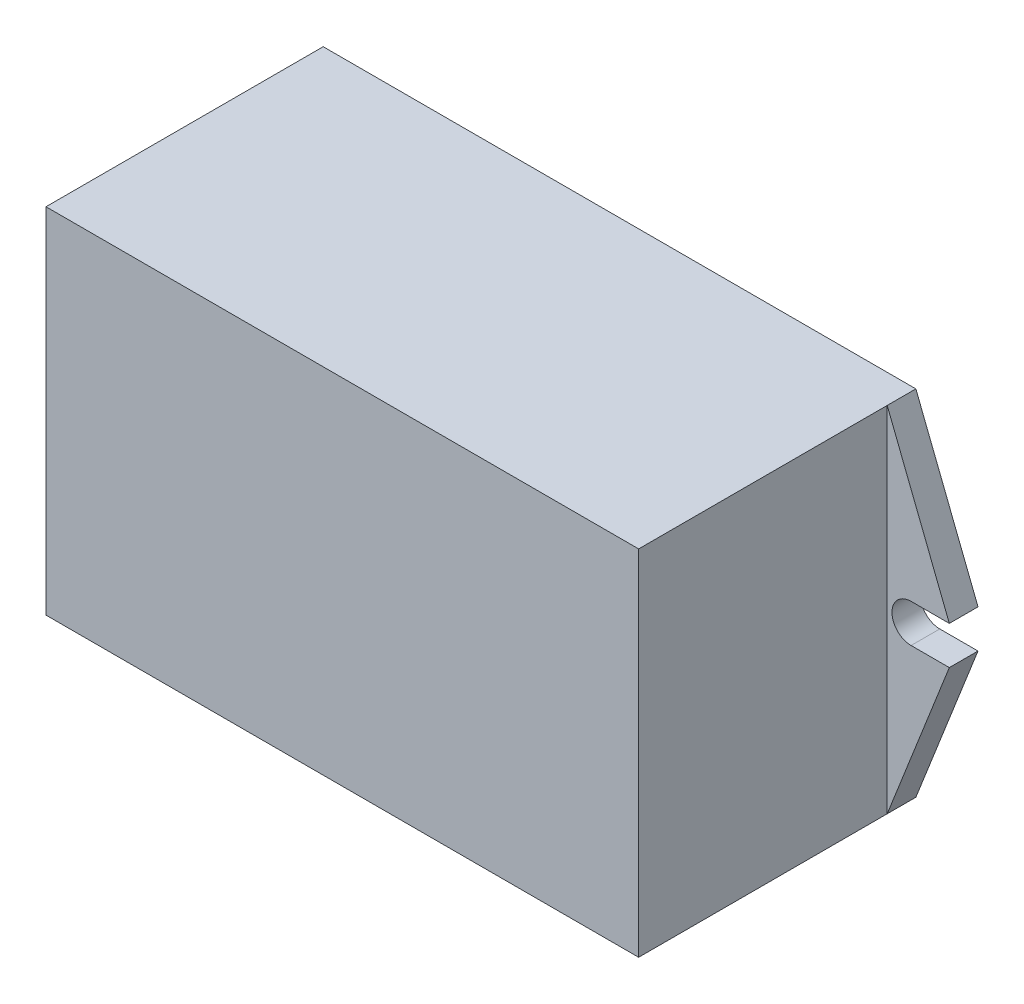
from build123d import *

# Parameters (mm, degrees)
EXTRUDE_1_DEPTH = 3
SKETCH_2_W      = 62
SKETCH_2_H      = 37
EXTRUDE_2_DEPTH = 26


with BuildPart() as part:
    # 草图1 → 凸台-拉伸1 (new body)
    with BuildSketch(Plane.XY):
        with BuildLine():
            Line((0, 0), (62, 0))
            Line((62, 0), (68.5, -16.5))
            Line((68.5, -16.5), (64.5, -16.5))
            ThreePointArc((64.5, -16.5), (62.5, -18.5), (64.5, -20.5))
            Line((64.5, -20.5), (68.5, -20.5))
            Line((68.5, -20.5), (62, -37))
            Line((62, -37), (0, -37))
            Line((0, -37), (-6.5, -20.5))
            Line((-6.5, -20.5), (-2.5, -20.5))
            ThreePointArc((-2.5, -20.5), (-0.5, -18.5), (-2.5, -16.5))
            Line((-2.5, -16.5), (-6.5, -16.5))
            Line((-6.5, -16.5), (0, 0))
        make_face()
    extrude(amount=EXTRUDE_1_DEPTH)

    # 草图2 → 凸台-拉伸2 (add)
    with BuildSketch(Plane.XY.offset(3)):
        with Locations((31, -18.5)):
            Rectangle(SKETCH_2_W, SKETCH_2_H)
    extrude(amount=EXTRUDE_2_DEPTH)


solid = part.part
